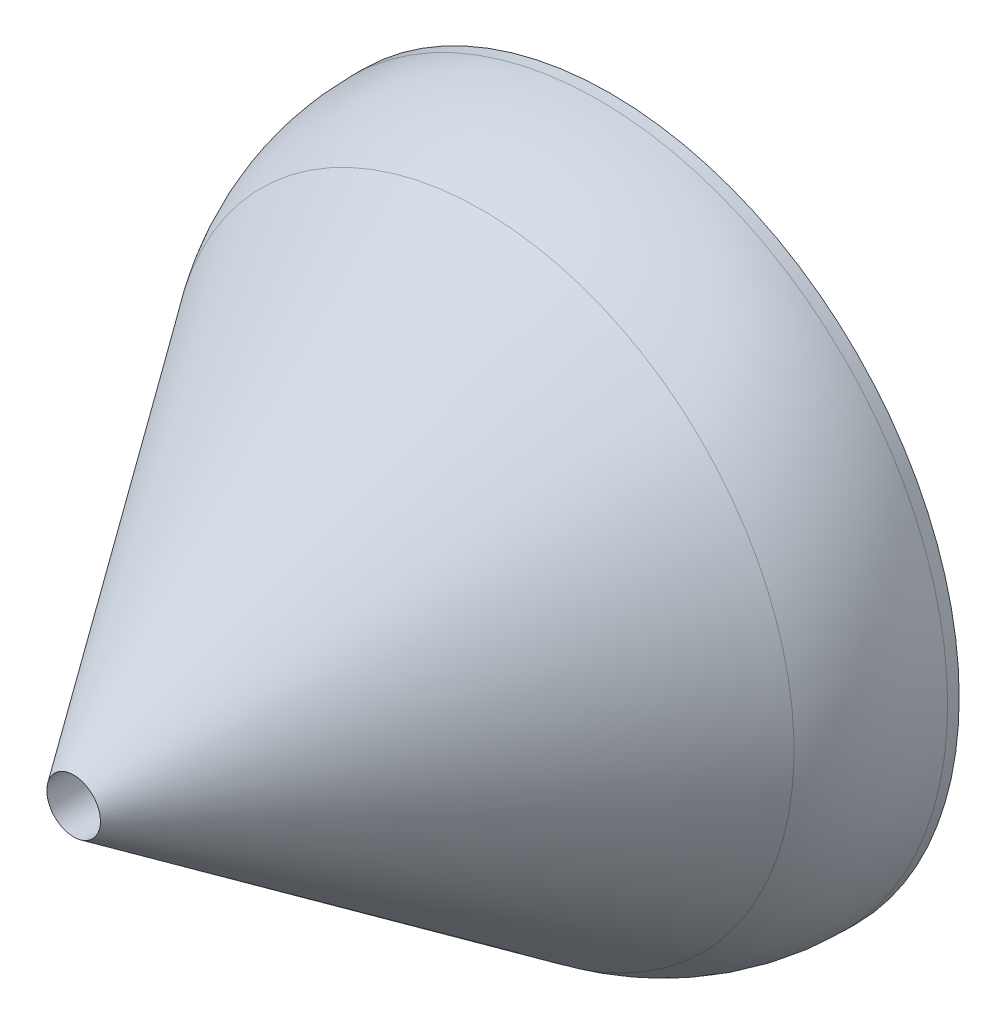
from build123d import *

# Parameters (mm, degrees)
FILLET1_R = 48.26


with BuildPart() as part:
    # Sketch2 → Revolve1 (revolve)
    with BuildSketch(Plane.YZ, mode=Mode.PRIVATE) as revolve1_sk:
        Polygon((-63.5, 0), (-63.5, 17.927965037), (-36.337085401, 56.808731059), (-6.35, 56.808731059), (-6.35, 69.508731059), (-27.464600347, 69.508731059), (-6.35, 99.731991259), (-6.35, 127), (-82.55, 17.927965037), (-82.55, 0), align=None)
    revolve(revolve1_sk.sketch.rotate(Axis((0, 0, 0), (0, 0, 1)), 270), axis=Axis((0, 0, 0), (0, 0, 1)))

    # Fillet1
    fillet1_edges = [part.edges().sort_by_distance(p)[0] for p in [
        (82.55, 0, 17.927965037),
    ]]
    fillet(fillet1_edges, radius=FILLET1_R)


solid = part.part
